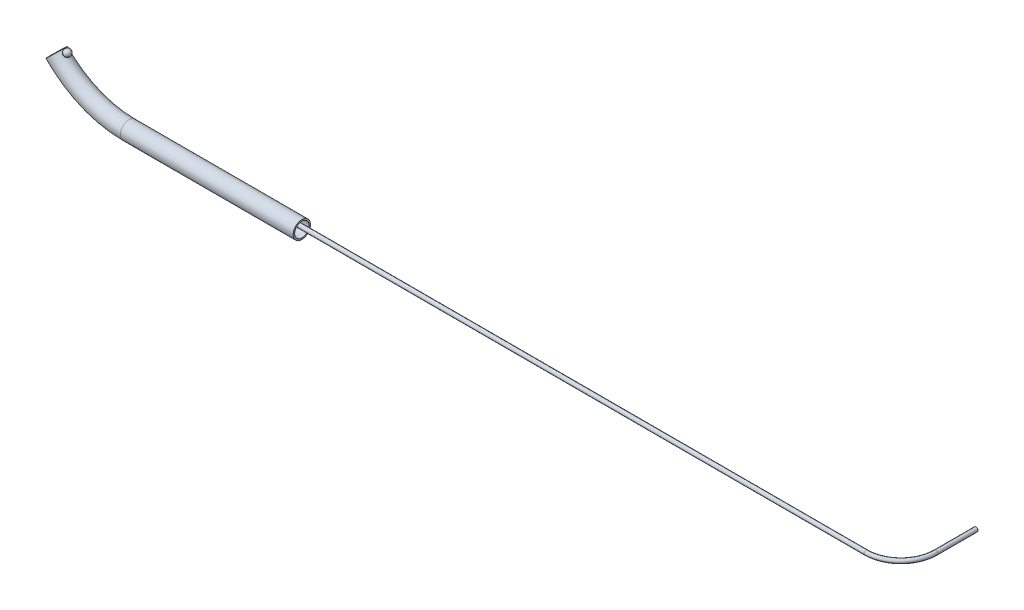
from build123d import *

# Parameters (mm, degrees)
SKETCH5_R           = 0.6223
SKETCH5_R_2         = 0.51435
SKETCH5_2_R         = 0.6223
SKETCH5_2_R_2       = 0.51435
BOSS_EXTRUDE2_DEPTH = 10
SKETCH8_R           = 0.15
SKETCH9_R           = 0.15
BOSS_EXTRUDE3_DEPTH = 40
SKETCH11_R          = 0.15


with BuildPart() as part:
    # Sweep2: sweep along a path in Sketch4
    with BuildLine(Plane.XY) as sweep2_path:
        Line((-65.954222951, 0), (-68.364968213, 0))
        ThreePointArc((-68.364968213, 0), (-71.186123393, 0.579815367), (-73.549932813, 2.225265895))
    # Sketch5 → Sweep2 (sweep)
    with BuildSketch(Plane(origin=(-65.954222951, 0, 0), x_dir=(0, 0, -1), z_dir=(1, 0, 0))):
        Circle(SKETCH5_R)
        Circle(SKETCH5_R_2, mode=Mode.SUBTRACT)
    sweep(path=sweep2_path.line)

    # Sketch5<2> → Boss-Extrude2 (add)
    with BuildSketch(Plane(origin=(-65.954222951, 0, 0), x_dir=(0, 0, -1), z_dir=(1, 0, 0))):
        Circle(SKETCH5_2_R)
        Circle(SKETCH5_2_R_2, mode=Mode.SUBTRACT)
    extrude(amount=BOSS_EXTRUDE2_DEPTH)

    # Sketch6 → Revolve2 (revolve)
    with BuildSketch(Plane.XY):
        with BuildLine():
            Line((-72.949063517, 2.38792888), (-72.625665662, 2.76926053))
            ThreePointArc((-72.625665662, 2.76926053), (-72.596698765, 2.416895777), (-72.949063517, 2.38792888))
        make_face()
    revolve(axis=Axis((-72.949063517, 2.38792888, 0), (0.6467957105420484, 0.7626632997754689, 0)))


with BuildPart() as body_2:
    # Sweep3: sweep along a path in Sketch7
    with BuildLine(Plane.XY) as sweep3_path:
        Line((-55.954222951, 0.1777), (-68.364968213, 0.1777))
        ThreePointArc((-68.364968213, 0.1777), (-71.116040444, 0.743111633), (-73.421128268, 2.347685988))
    # Sketch8 → Sweep3 (sweep)
    with BuildSketch(Plane(origin=(-36.018221468, 37.89664365, 0), x_dir=(0.7248426853938525, 0.688914422429251, 0), z_dir=(-0.688914422429251, 0.7248426853938525, 0))):
        with Locations((-51.601413042, 0)):
            Circle(SKETCH8_R)
    sweep(path=sweep3_path.line)

    # Sketch9 → Boss-Extrude3 (add)
    with BuildSketch(Plane(origin=(-55.954222951, 0, 0), x_dir=(0, 0, -1), z_dir=(1, 0, 0))):
        with Locations((0, 0.1777)):
            Circle(SKETCH9_R)
    extrude(amount=BOSS_EXTRUDE3_DEPTH)

    # Sweep4: sweep along a path in Sketch10
    with BuildLine(Plane(origin=(-32.524934282, 0.1777, -2.743586274), x_dir=(1, 0, 0), z_dir=(0, -1, 0))) as sweep4_path:
        Line((16.570711331, 2.743586274), (17.070711331, 2.743586274))
        ThreePointArc((17.070711331, 2.743586274), (18.838478284, 2.011353227), (19.570711331, 0.243586274))
        Line((19.570711331, 0.243586274), (19.570711331, -2.637865197))
    # Sketch11 → Sweep4 (sweep)
    with BuildSketch(Plane(origin=(-15.954222951, 0, 0), x_dir=(0, 0, -1), z_dir=(1, 0, 0))):
        with Locations((0, 0.1777)):
            Circle(SKETCH11_R)
    sweep(path=sweep4_path.line)


solid = Compound([part.part, body_2.part])
